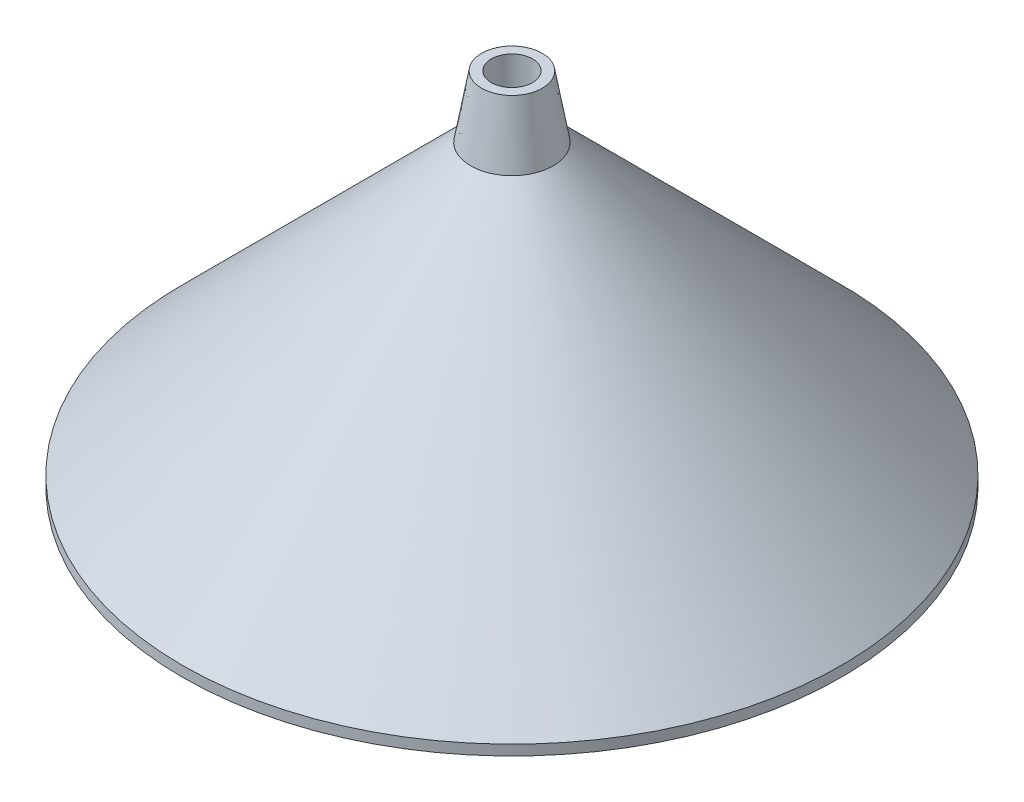
from build123d import *

# Parameters (mm, degrees)
SKETCH_2_R          = 32
EXTRUDE_2_DEPTH     = 1
SKETCH_3_R          = 32
EXTRUDE_3_DEPTH     = 28
EXTRUDE_3_TAPER     = 45
SKETCH_5_R          = 30
CUT_EXTRUDE_1_DEPTH = 1
SKETCH_6_R          = 30
CUT_EXTRUDE_2_DEPTH = 28
CUT_EXTRUDE_2_DRAFT = -45
SKETCH_7_R          = 4
EXTRUDE_5_DEPTH     = 6
EXTRUDE_5_TAPER     = 10
SKETCH_10_R         = 2
CUT_EXTRUDE_3_DEPTH = 54.749418721


with BuildPart() as part:
    # 草图2 → 凸台-拉伸2 (new body)
    with BuildSketch(Plane(origin=(0, 0, 0), x_dir=(1, 0, 0), z_dir=(0, 1, 0))):
        with Locations(Location((0, 0, 0), (0, 0, 270))):
            Circle(SKETCH_2_R)
    extrude(amount=EXTRUDE_2_DEPTH)

    # 草图3 → 凸台-拉伸3 (add)
    with BuildSketch(Plane(origin=(0, 1, 0), x_dir=(1, 0, 0), z_dir=(0, 1, 0))):
        with Locations(Location((0, 0, 0), (0, 0, 270))):
            Circle(SKETCH_3_R)
    extrude(amount=EXTRUDE_3_DEPTH, taper=EXTRUDE_3_TAPER)

    # 草图5 → 切除-拉伸1 (cut)
    with BuildSketch(Plane(origin=(0, 0, 0), x_dir=(-1, 0, 0), z_dir=(0, -1, 0))):
        with Locations(Location((0, 0, 0), (0, 0, 90))):
            Circle(SKETCH_5_R)
    extrude(amount=-CUT_EXTRUDE_1_DEPTH, mode=Mode.SUBTRACT)


with BuildPart() as cut_extrude_2_tool:
    # 草图6 → 切除-拉伸2 (with draft: the straight prism first)
    with BuildSketch(Plane(origin=(0, 1, 0), x_dir=(-1, 0, 0), z_dir=(0, -1, 0))):
        with Locations(Location((0, 0, 0), (0, 0, 90))):
            Circle(SKETCH_6_R)
    extrude(amount=-CUT_EXTRUDE_2_DEPTH)
    # 切除-拉伸2: the draft: its side faces are tilted about the plane it starts from
    cut_extrude_2_sides = [cut_extrude_2_tool.faces().sort_by_distance(p)[0] for p in [
        (0, 15, 30),
    ]]
    draft(cut_extrude_2_sides, Plane(origin=(0, 1, 0), x_dir=(-1, 0, 0), z_dir=(0, -1, 0)), CUT_EXTRUDE_2_DRAFT)


with BuildPart() as part_1:
    add(part.part)

    # 切除-拉伸2: cut by cut_extrude_2_tool
    add(cut_extrude_2_tool.part, mode=Mode.SUBTRACT)

    # 草图7 → 凸台-拉伸5 (add)
    with BuildSketch(Plane(origin=(0, 29, 0), x_dir=(1, 0, 0), z_dir=(0, 1, 0))):
        Circle(SKETCH_7_R)
    extrude(amount=EXTRUDE_5_DEPTH, taper=EXTRUDE_5_TAPER)

    # 草图10 → 切除-拉伸3 (cut, through all)
    with BuildSketch(Plane(origin=(0, 29, 0), x_dir=(-1, 0, 0), z_dir=(0, -1, 0))):
        with Locations(Location((0, 0, 0), (0, 0, 90))):
            Circle(SKETCH_10_R)
    extrude(amount=-CUT_EXTRUDE_3_DEPTH, mode=Mode.SUBTRACT)


solid = part_1.part
